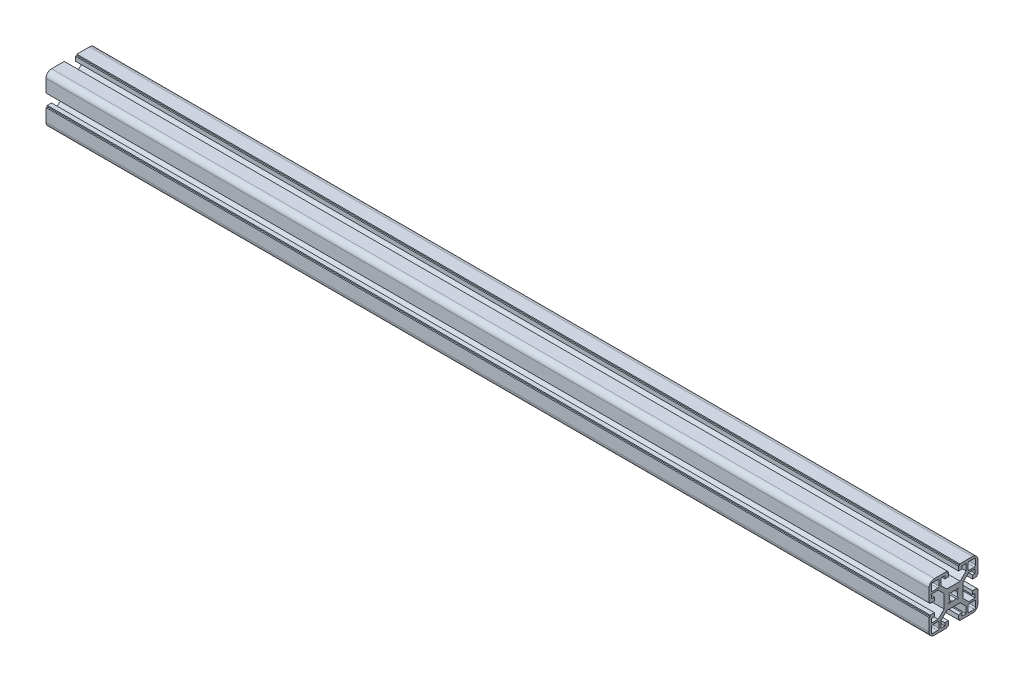
from build123d import *

# Parameters (mm, degrees)
EXTRUDE_1_DEPTH     = 50
EXTRUDE_2_DEPTH     = 720
CUT_EXTRUDE_START   = 20.27996
SKETCH_4_R          = 3
CUT_EXTRUDE_1_DEPTH = 40


with BuildPart() as part:
    # 草图1 → 凸台-拉伸1 (new body)
    with BuildSketch(Plane(origin=(0, 0, 0), x_dir=(0, 0, -1), z_dir=(1, 0, 0))):
        with BuildLine():
            Line((4.82004008, 19.27995992), (3.82004008, 19.27995992))
            Line((3.82004008, 19.27995992), (3.82004008, 15.77995992))
            Line((3.82004008, 15.77995992), (6.73639159, 15.77995992))
            Line((6.73639159, 15.77995992), (6.73639159, 18.02995992))
            Line((6.73639159, 18.02995992), (10.02004008, 18.02995992))
            Line((10.02004008, 18.02995992), (10.02004008, 12.70128026))
            Line((10.02004008, 12.70128026), (5.19871974, 7.87995992))
            Line((5.19871974, 7.87995992), (-5.75863958, 7.87995992))
            Line((-5.75863958, 7.87995992), (-10.57995992, 12.70128026))
            Line((-10.57995992, 12.70128026), (-10.57995992, 18.02995992))
            Line((-10.57995992, 18.02995992), (-7.29631143, 18.02995992))
            Line((-7.29631143, 18.02995992), (-7.29631143, 15.77995992))
            Line((-7.29631143, 15.77995992), (-4.37995992, 15.77995992))
            Line((-4.37995992, 15.77995992), (-4.37995992, 19.27995992))
            Line((-4.37995992, 19.27995992), (-5.37995992, 19.27995992))
            Line((-5.37995992, 19.27995992), (-5.37995992, 20.27995992))
            Line((-5.37995992, 20.27995992), (-15.77995992, 20.27995992))
            ThreePointArc((-15.77995992, 20.27995992), (-18.961940435, 18.961940435), (-20.27995992, 15.77995992))
            Line((-20.27995992, 15.77995992), (-20.27995992, 5.37995992))
            Line((-20.27995992, 5.37995992), (-19.27995992, 5.37995992))
            Line((-19.27995992, 5.37995992), (-19.27995992, 4.37995992))
            Line((-19.27995992, 4.37995992), (-15.77995992, 4.37995992))
            Line((-15.77995992, 4.37995992), (-15.77995992, 7.29631143))
            Line((-15.77995992, 7.29631143), (-18.02995992, 7.29631143))
            Line((-18.02995992, 7.29631143), (-18.02995992, 10.57995992))
            Line((-18.02995992, 10.57995992), (-12.70128026, 10.57995992))
            Line((-12.70128026, 10.57995992), (-7.87995992, 5.75863958))
            Line((-7.87995992, 5.75863958), (-7.87995992, -5.19871974))
            Line((-7.87995992, -5.19871974), (-12.70128026, -10.02004008))
            Line((-12.70128026, -10.02004008), (-18.02995992, -10.02004008))
            Line((-18.02995992, -10.02004008), (-18.02995992, -6.73639159))
            Line((-18.02995992, -6.73639159), (-15.77995992, -6.73639159))
            Line((-15.77995992, -6.73639159), (-15.77995992, -3.82004008))
            Line((-15.77995992, -3.82004008), (-19.27995992, -3.82004008))
            Line((-19.27995992, -3.82004008), (-19.27995992, -4.82004008))
            Line((-19.27995992, -4.82004008), (-20.27995992, -4.82004008))
            Line((-20.27995992, -4.82004008), (-20.27995992, -15.22004008))
            ThreePointArc((-20.27995992, -15.22004008), (-18.961940435, -18.402020595), (-15.77995992, -19.72004008))
            Line((-15.77995992, -19.72004008), (-5.37995992, -19.72004008))
            Line((-5.37995992, -19.72004008), (-5.37995992, -18.72004008))
            Line((-5.37995992, -18.72004008), (-4.37995992, -18.72004008))
            Line((-4.37995992, -18.72004008), (-4.37995992, -15.22004008))
            Line((-4.37995992, -15.22004008), (-7.29631143, -15.22004008))
            Line((-7.29631143, -15.22004008), (-7.29631143, -17.47004008))
            Line((-7.29631143, -17.47004008), (-10.57995992, -17.47004008))
            Line((-10.57995992, -17.47004008), (-10.57995992, -12.14136042))
            Line((-10.57995992, -12.14136042), (-5.75863958, -7.32004008))
            Line((-5.75863958, -7.32004008), (5.19871974, -7.32004008))
            Line((5.19871974, -7.32004008), (10.02004008, -12.14136042))
            Line((10.02004008, -12.14136042), (10.02004008, -17.47004008))
            Line((10.02004008, -17.47004008), (6.73639159, -17.47004008))
            Line((6.73639159, -17.47004008), (6.73639159, -15.22004008))
            Line((6.73639159, -15.22004008), (3.82004008, -15.22004008))
            Line((3.82004008, -15.22004008), (3.82004008, -18.72004008))
            Line((3.82004008, -18.72004008), (4.82004008, -18.72004008))
            Line((4.82004008, -18.72004008), (4.82004008, -19.72004008))
            Line((4.82004008, -19.72004008), (15.22004008, -19.72004008))
            ThreePointArc((15.22004008, -19.72004008), (18.402020595, -18.402020595), (19.72004008, -15.22004008))
            Line((19.72004008, -15.22004008), (19.72004008, -4.82004008))
            Line((19.72004008, -4.82004008), (18.72004008, -4.82004008))
            Line((18.72004008, -4.82004008), (18.72004008, -3.82004008))
            Line((18.72004008, -3.82004008), (15.22004008, -3.82004008))
            Line((15.22004008, -3.82004008), (15.22004008, -6.73639159))
            Line((15.22004008, -6.73639159), (17.47004008, -6.73639159))
            Line((17.47004008, -6.73639159), (17.47004008, -10.02004008))
            Line((17.47004008, -10.02004008), (12.14136042, -10.02004008))
            Line((12.14136042, -10.02004008), (7.32004008, -5.19871974))
            Line((7.32004008, -5.19871974), (7.32004008, 5.75863958))
            Line((7.32004008, 5.75863958), (12.14136042, 10.57995992))
            Line((12.14136042, 10.57995992), (17.47004008, 10.57995992))
            Line((17.47004008, 10.57995992), (17.47004008, 7.29631143))
            Line((17.47004008, 7.29631143), (15.22004008, 7.29631143))
            Line((15.22004008, 7.29631143), (15.22004008, 4.37995992))
            Line((15.22004008, 4.37995992), (18.72004008, 4.37995992))
            Line((18.72004008, 4.37995992), (18.72004008, 5.37995992))
            Line((18.72004008, 5.37995992), (19.72004008, 5.37995992))
            Line((19.72004008, 5.37995992), (19.72004008, 15.77995992))
            ThreePointArc((19.72004008, 15.77995992), (18.402020595, 18.961940435), (15.22004008, 20.27995992))
            Line((15.22004008, 20.27995992), (4.82004008, 20.27995992))
            Line((4.82004008, 20.27995992), (4.82004008, 19.27995992))
        make_face()
        with BuildLine():
            Line((-13.07995992, -17.72004008), (-17.27995992, -17.72004008))
            ThreePointArc((-17.27995992, -17.72004008), (-17.987066701, -17.427146861), (-18.27995992, -16.72004008))
            Line((-18.27995992, -16.72004008), (-18.27995992, -12.52004008))
            ThreePointArc((-18.27995992, -12.52004008), (-17.987066701, -11.812933299), (-17.27995992, -11.52004008))
            Line((-17.27995992, -11.52004008), (-13.07995992, -11.52004008))
            ThreePointArc((-13.07995992, -11.52004008), (-12.372853139, -11.812933299), (-12.07995992, -12.52004008))
            Line((-12.07995992, -12.52004008), (-12.07995992, -16.72004008))
            ThreePointArc((-12.07995992, -16.72004008), (-12.372853139, -17.427146861), (-13.07995992, -17.72004008))
        make_face(mode=Mode.SUBTRACT)
        with BuildLine():
            Line((-17.27995992, 18.27995992), (-13.07995992, 18.27995992))
            ThreePointArc((-13.07995992, 18.27995992), (-12.372853139, 17.987066701), (-12.07995992, 17.27995992))
            Line((-12.07995992, 17.27995992), (-12.07995992, 13.07995992))
            ThreePointArc((-12.07995992, 13.07995992), (-12.372853139, 12.372853139), (-13.07995992, 12.07995992))
            Line((-13.07995992, 12.07995992), (-17.27995992, 12.07995992))
            ThreePointArc((-17.27995992, 12.07995992), (-17.987066701, 12.372853139), (-18.27995992, 13.07995992))
            Line((-18.27995992, 13.07995992), (-18.27995992, 17.27995992))
            ThreePointArc((-18.27995992, 17.27995992), (-17.987066701, 17.987066701), (-17.27995992, 18.27995992))
        make_face(mode=Mode.SUBTRACT)
        with BuildLine():
            Line((16.72004008, 12.07995992), (12.52004008, 12.07995992))
            ThreePointArc((12.52004008, 12.07995992), (11.812933299, 12.372853139), (11.52004008, 13.07995992))
            Line((11.52004008, 13.07995992), (11.52004008, 17.27995992))
            ThreePointArc((11.52004008, 17.27995992), (11.812933299, 17.987066701), (12.52004008, 18.27995992))
            Line((12.52004008, 18.27995992), (16.72004008, 18.27995992))
            ThreePointArc((16.72004008, 18.27995992), (17.427146861, 17.987066701), (17.72004008, 17.27995992))
            Line((17.72004008, 17.27995992), (17.72004008, 13.07995992))
            ThreePointArc((17.72004008, 13.07995992), (17.427146861, 12.372853139), (16.72004008, 12.07995992))
        make_face(mode=Mode.SUBTRACT)
        with BuildLine():
            Line((3.75045895, -3.04335217), (3.04335217, -3.75045895))
            Line((3.04335217, -3.75045895), (1.74451108, -2.45161786))
            ThreePointArc((1.74451108, -2.45161786), (-0.27995992, -3.12004008), (-2.30443092, -2.45161786))
            Line((-2.30443092, -2.45161786), (-3.60327201, -3.75045895))
            Line((-3.60327201, -3.75045895), (-4.31037879, -3.04335217))
            Line((-4.31037879, -3.04335217), (-3.0115377, -1.74451108))
            ThreePointArc((-3.0115377, -1.74451108), (-3.67995992, 0.27995992), (-3.0115377, 2.30443092))
            Line((-3.0115377, 2.30443092), (-4.31037879, 3.60327201))
            Line((-4.31037879, 3.60327201), (-3.60327201, 4.31037879))
            Line((-3.60327201, 4.31037879), (-2.30443092, 3.0115377))
            ThreePointArc((-2.30443092, 3.0115377), (-0.27995992, 3.67995992), (1.74451108, 3.0115377))
            Line((1.74451108, 3.0115377), (3.04335217, 4.31037879))
            Line((3.04335217, 4.31037879), (3.75045895, 3.60327201))
            Line((3.75045895, 3.60327201), (2.45161786, 2.30443092))
            ThreePointArc((2.45161786, 2.30443092), (3.12004008, 0.27995992), (2.45161786, -1.74451108))
            Line((2.45161786, -1.74451108), (3.75045895, -3.04335217))
        make_face(mode=Mode.SUBTRACT)
        with BuildLine():
            Line((17.72004008, -12.52004008), (17.72004008, -16.72004008))
            ThreePointArc((17.72004008, -16.72004008), (17.427146861, -17.427146861), (16.72004008, -17.72004008))
            Line((16.72004008, -17.72004008), (12.52004008, -17.72004008))
            ThreePointArc((12.52004008, -17.72004008), (11.812933299, -17.427146861), (11.52004008, -16.72004008))
            Line((11.52004008, -16.72004008), (11.52004008, -12.52004008))
            ThreePointArc((11.52004008, -12.52004008), (11.812933299, -11.812933299), (12.52004008, -11.52004008))
            Line((12.52004008, -11.52004008), (16.72004008, -11.52004008))
            ThreePointArc((16.72004008, -11.52004008), (17.427146861, -11.812933299), (17.72004008, -12.52004008))
        make_face(mode=Mode.SUBTRACT)
    extrude(amount=-EXTRUDE_1_DEPTH)

    # 草图2 → 凸台-拉伸2 (add)
    with BuildSketch(Plane(origin=(0, 0, 0), x_dir=(0, 0, -1), z_dir=(1, 0, 0))):
        with BuildLine():
            Line((19.72004008, 5.37995992), (19.72004008, 15.77995992))
            ThreePointArc((19.72004008, 15.77995992), (18.402020595, 18.961940435), (15.22004008, 20.27995992))
            Line((15.22004008, 20.27995992), (4.82004008, 20.27995992))
            Line((4.82004008, 20.27995992), (4.82004008, 19.27995992))
            Line((4.82004008, 19.27995992), (3.82004008, 19.27995992))
            Line((3.82004008, 19.27995992), (3.82004008, 15.77995992))
            Line((3.82004008, 15.77995992), (6.73639159, 15.77995992))
            Line((6.73639159, 15.77995992), (6.73639159, 18.02995992))
            Line((6.73639159, 18.02995992), (10.02004008, 18.02995992))
            Line((10.02004008, 18.02995992), (10.02004008, 12.70128026))
            Line((10.02004008, 12.70128026), (5.19871974, 7.87995992))
            Line((5.19871974, 7.87995992), (-5.75863958, 7.87995992))
            Line((-5.75863958, 7.87995992), (-10.57995992, 12.70128026))
            Line((-10.57995992, 12.70128026), (-10.57995992, 18.02995992))
            Line((-10.57995992, 18.02995992), (-7.29631143, 18.02995992))
            Line((-7.29631143, 18.02995992), (-7.29631143, 15.77995992))
            Line((-7.29631143, 15.77995992), (-4.37995992, 15.77995992))
            Line((-4.37995992, 15.77995992), (-4.37995992, 19.27995992))
            Line((-4.37995992, 19.27995992), (-5.37995992, 19.27995992))
            Line((-5.37995992, 19.27995992), (-5.37995992, 20.27995992))
            Line((-5.37995992, 20.27995992), (-15.77995992, 20.27995992))
            ThreePointArc((-15.77995992, 20.27995992), (-18.961940435, 18.961940435), (-20.27995992, 15.77995992))
            Line((-20.27995992, 15.77995992), (-20.27995992, 5.37995992))
            Line((-20.27995992, 5.37995992), (-19.27995992, 5.37995992))
            Line((-19.27995992, 5.37995992), (-19.27995992, 4.37995992))
            Line((-19.27995992, 4.37995992), (-15.77995992, 4.37995992))
            Line((-15.77995992, 4.37995992), (-15.77995992, 7.29631143))
            Line((-15.77995992, 7.29631143), (-18.02995992, 7.29631143))
            Line((-18.02995992, 7.29631143), (-18.02995992, 10.57995992))
            Line((-18.02995992, 10.57995992), (-12.70128026, 10.57995992))
            Line((-12.70128026, 10.57995992), (-7.87995992, 5.75863958))
            Line((-7.87995992, 5.75863958), (-7.87995992, -5.19871974))
            Line((-7.87995992, -5.19871974), (-12.70128026, -10.02004008))
            Line((-12.70128026, -10.02004008), (-18.02995992, -10.02004008))
            Line((-18.02995992, -10.02004008), (-18.02995992, -6.73639159))
            Line((-18.02995992, -6.73639159), (-15.77995992, -6.73639159))
            Line((-15.77995992, -6.73639159), (-15.77995992, -3.82004008))
            Line((-15.77995992, -3.82004008), (-19.27995992, -3.82004008))
            Line((-19.27995992, -3.82004008), (-19.27995992, -4.82004008))
            Line((-19.27995992, -4.82004008), (-20.27995992, -4.82004008))
            Line((-20.27995992, -4.82004008), (-20.27995992, -15.22004008))
            ThreePointArc((-20.27995992, -15.22004008), (-18.961940435, -18.402020595), (-15.77995992, -19.72004008))
            Line((-15.77995992, -19.72004008), (-5.37995992, -19.72004008))
            Line((-5.37995992, -19.72004008), (-5.37995992, -18.72004008))
            Line((-5.37995992, -18.72004008), (-4.37995992, -18.72004008))
            Line((-4.37995992, -18.72004008), (-4.37995992, -15.22004008))
            Line((-4.37995992, -15.22004008), (-7.29631143, -15.22004008))
            Line((-7.29631143, -15.22004008), (-7.29631143, -17.47004008))
            Line((-7.29631143, -17.47004008), (-10.57995992, -17.47004008))
            Line((-10.57995992, -17.47004008), (-10.57995992, -12.14136042))
            Line((-10.57995992, -12.14136042), (-5.75863958, -7.32004008))
            Line((-5.75863958, -7.32004008), (5.19871974, -7.32004008))
            Line((5.19871974, -7.32004008), (10.02004008, -12.14136042))
            Line((10.02004008, -12.14136042), (10.02004008, -17.47004008))
            Line((10.02004008, -17.47004008), (6.73639159, -17.47004008))
            Line((6.73639159, -17.47004008), (6.73639159, -15.22004008))
            Line((6.73639159, -15.22004008), (3.82004008, -15.22004008))
            Line((3.82004008, -15.22004008), (3.82004008, -18.72004008))
            Line((3.82004008, -18.72004008), (4.82004008, -18.72004008))
            Line((4.82004008, -18.72004008), (4.82004008, -19.72004008))
            Line((4.82004008, -19.72004008), (15.22004008, -19.72004008))
            ThreePointArc((15.22004008, -19.72004008), (18.402020595, -18.402020595), (19.72004008, -15.22004008))
            Line((19.72004008, -15.22004008), (19.72004008, -4.82004008))
            Line((19.72004008, -4.82004008), (18.72004008, -4.82004008))
            Line((18.72004008, -4.82004008), (18.72004008, -3.82004008))
            Line((18.72004008, -3.82004008), (15.22004008, -3.82004008))
            Line((15.22004008, -3.82004008), (15.22004008, -6.73639159))
            Line((15.22004008, -6.73639159), (17.47004008, -6.73639159))
            Line((17.47004008, -6.73639159), (17.47004008, -10.02004008))
            Line((17.47004008, -10.02004008), (12.14136042, -10.02004008))
            Line((12.14136042, -10.02004008), (7.32004008, -5.19871974))
            Line((7.32004008, -5.19871974), (7.32004008, 5.75863958))
            Line((7.32004008, 5.75863958), (12.14136042, 10.57995992))
            Line((12.14136042, 10.57995992), (17.47004008, 10.57995992))
            Line((17.47004008, 10.57995992), (17.47004008, 7.29631143))
            Line((17.47004008, 7.29631143), (15.22004008, 7.29631143))
            Line((15.22004008, 7.29631143), (15.22004008, 4.37995992))
            Line((15.22004008, 4.37995992), (18.72004008, 4.37995992))
            Line((18.72004008, 4.37995992), (18.72004008, 5.37995992))
            Line((18.72004008, 5.37995992), (19.72004008, 5.37995992))
        make_face()
        with BuildLine():
            Line((-17.27995992, -17.72004008), (-13.07995992, -17.72004008))
            ThreePointArc((-13.07995992, -17.72004008), (-12.372853139, -17.427146861), (-12.07995992, -16.72004008))
            Line((-12.07995992, -16.72004008), (-12.07995992, -12.52004008))
            ThreePointArc((-12.07995992, -12.52004008), (-12.372853139, -11.812933299), (-13.07995992, -11.52004008))
            Line((-13.07995992, -11.52004008), (-17.27995992, -11.52004008))
            ThreePointArc((-17.27995992, -11.52004008), (-17.987066701, -11.812933299), (-18.27995992, -12.52004008))
            Line((-18.27995992, -12.52004008), (-18.27995992, -16.72004008))
            ThreePointArc((-18.27995992, -16.72004008), (-17.987066701, -17.427146861), (-17.27995992, -17.72004008))
        make_face(mode=Mode.SUBTRACT)
        with BuildLine():
            Line((-13.07995992, 18.27995992), (-17.27995992, 18.27995992))
            ThreePointArc((-17.27995992, 18.27995992), (-17.987066701, 17.987066701), (-18.27995992, 17.27995992))
            Line((-18.27995992, 17.27995992), (-18.27995992, 13.07995992))
            ThreePointArc((-18.27995992, 13.07995992), (-17.987066701, 12.372853139), (-17.27995992, 12.07995992))
            Line((-17.27995992, 12.07995992), (-13.07995992, 12.07995992))
            ThreePointArc((-13.07995992, 12.07995992), (-12.372853139, 12.372853139), (-12.07995992, 13.07995992))
            Line((-12.07995992, 13.07995992), (-12.07995992, 17.27995992))
            ThreePointArc((-12.07995992, 17.27995992), (-12.372853139, 17.987066701), (-13.07995992, 18.27995992))
        make_face(mode=Mode.SUBTRACT)
        with BuildLine():
            Line((11.52004008, 17.27995992), (11.52004008, 13.07995992))
            ThreePointArc((11.52004008, 13.07995992), (11.812933299, 12.372853139), (12.52004008, 12.07995992))
            Line((12.52004008, 12.07995992), (16.72004008, 12.07995992))
            ThreePointArc((16.72004008, 12.07995992), (17.427146861, 12.372853139), (17.72004008, 13.07995992))
            Line((17.72004008, 13.07995992), (17.72004008, 17.27995992))
            ThreePointArc((17.72004008, 17.27995992), (17.427146861, 17.987066701), (16.72004008, 18.27995992))
            Line((16.72004008, 18.27995992), (12.52004008, 18.27995992))
            ThreePointArc((12.52004008, 18.27995992), (11.812933299, 17.987066701), (11.52004008, 17.27995992))
        make_face(mode=Mode.SUBTRACT)
        with BuildLine():
            Line((11.52004008, -12.52004008), (11.52004008, -16.72004008))
            ThreePointArc((11.52004008, -16.72004008), (11.812933299, -17.427146861), (12.52004008, -17.72004008))
            Line((12.52004008, -17.72004008), (16.72004008, -17.72004008))
            ThreePointArc((16.72004008, -17.72004008), (17.427146861, -17.427146861), (17.72004008, -16.72004008))
            Line((17.72004008, -16.72004008), (17.72004008, -12.52004008))
            ThreePointArc((17.72004008, -12.52004008), (17.427146861, -11.812933299), (16.72004008, -11.52004008))
            Line((16.72004008, -11.52004008), (12.52004008, -11.52004008))
            ThreePointArc((12.52004008, -11.52004008), (11.812933299, -11.812933299), (11.52004008, -12.52004008))
        make_face(mode=Mode.SUBTRACT)
        with BuildLine():
            Line((-4.31037879, 3.60327201), (-3.0115377, 2.30443092))
            ThreePointArc((-3.0115377, 2.30443092), (-3.67995992, 0.27995992), (-3.0115377, -1.74451108))
            Line((-3.0115377, -1.74451108), (-4.31037879, -3.04335217))
            Line((-4.31037879, -3.04335217), (-3.60327201, -3.75045895))
            Line((-3.60327201, -3.75045895), (-2.30443092, -2.45161786))
            ThreePointArc((-2.30443092, -2.45161786), (-0.27995992, -3.12004008), (1.74451108, -2.45161786))
            Line((1.74451108, -2.45161786), (3.04335217, -3.75045895))
            Line((3.04335217, -3.75045895), (3.75045895, -3.04335217))
            Line((3.75045895, -3.04335217), (2.45161786, -1.74451108))
            ThreePointArc((2.45161786, -1.74451108), (3.12004008, 0.27995992), (2.45161786, 2.30443092))
            Line((2.45161786, 2.30443092), (3.75045895, 3.60327201))
            Line((3.75045895, 3.60327201), (3.04335217, 4.31037879))
            Line((3.04335217, 4.31037879), (1.74451108, 3.0115377))
            ThreePointArc((1.74451108, 3.0115377), (-0.27995992, 3.67995992), (-2.30443092, 3.0115377))
            Line((-2.30443092, 3.0115377), (-3.60327201, 4.31037879))
            Line((-3.60327201, 4.31037879), (-4.31037879, 3.60327201))
        make_face(mode=Mode.SUBTRACT)
    extrude(amount=-EXTRUDE_2_DEPTH)

    # 草图4 → 切除-拉伸1 (cut)
    with BuildSketch(Plane(origin=(0, 0, 0), x_dir=(1, 0, 0), z_dir=(0, 1, 0)).offset(CUT_EXTRUDE_START)):
        with Locations(Location((-382.5, -0.27995992, 0), (0, 0, 270))):
            Circle(SKETCH_4_R)
        with Locations(Location((-337.5, -0.27995992, 0), (0, 0, 270))):
            Circle(SKETCH_4_R)
        with Locations(Location((-320, -0.27995992, 0), (0, 0, 270))):
            Circle(SKETCH_4_R)
        with Locations(Location((-400, -0.27995992, 0), (0, 0, 270))):
            Circle(SKETCH_4_R)
    extrude(amount=-CUT_EXTRUDE_1_DEPTH, mode=Mode.SUBTRACT)


solid = part.part
